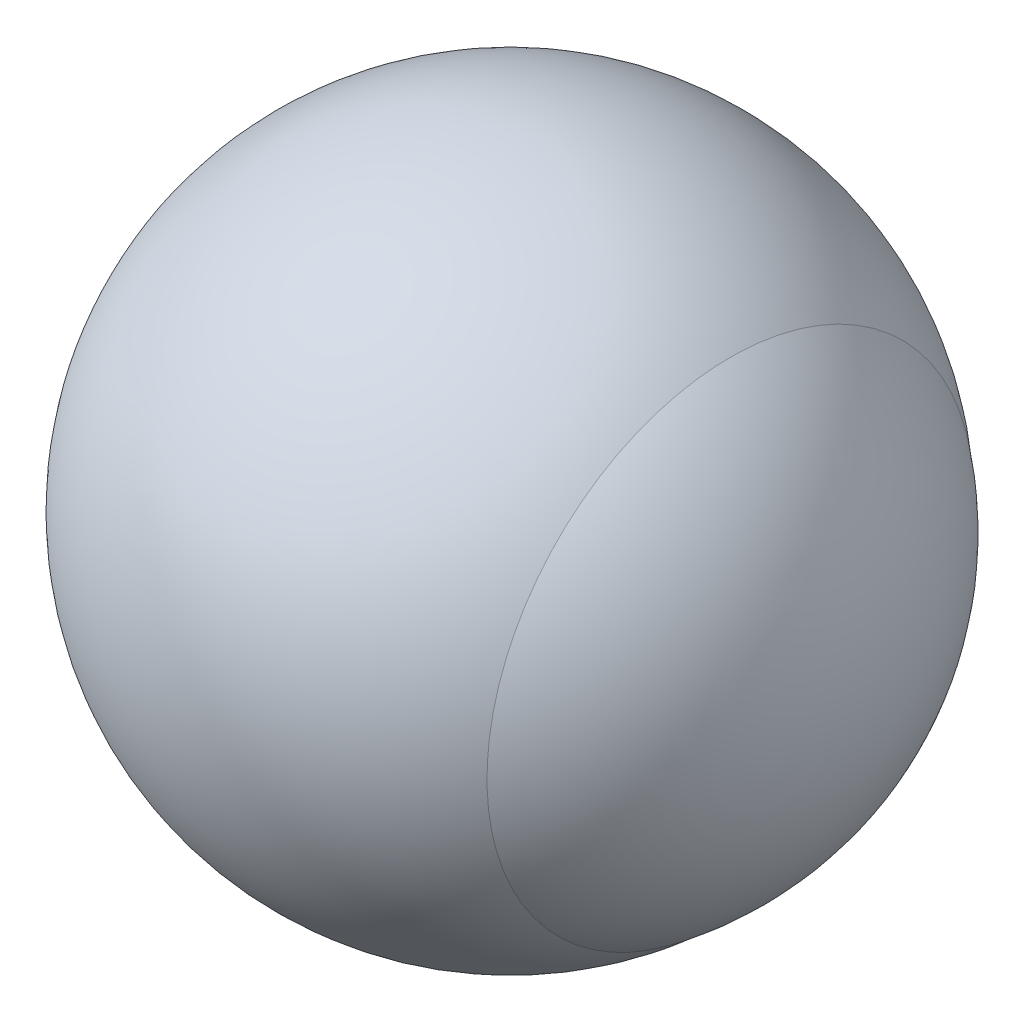
from build123d import *


with BuildPart() as part:
    # Эскиз5 → Повернуть1 (revolve)
    with BuildSketch(Plane(origin=(-13.435028843, 0, 0), x_dir=(0, 0, -1), z_dir=(1, 0, 0))):
        with BuildLine():
            Line((-10.564971157, 26.870057685), (37.435028843, 26.870057685))
            ThreePointArc((37.435028843, 26.870057685), (13.435028843, 50.870057685), (-10.564971157, 26.870057685))
        make_face()
    revolve(axis=Axis((-13.435028843, 26.870057685, 10.564971157), (0, 0, -1)))

    # Эскиз6 → Повернуть5 (revolve)
    with BuildSketch(Plane.XY.offset(-13.435028843)):
        with BuildLine():
            Line((11.564971157, 26.870057685), (10.564971157, 26.870057685))
            ThreePointArc((10.564971157, 26.870057685), (8.50114391, 36.606808939), (2.664610742, 44.668979148))
            ThreePointArc((2.664610742, 44.668979148), (9.215858607, 36.820158448), (11.564971157, 26.870057685))
        make_face()
    revolve(axis=Axis((11.564971157, 26.870057685, -13.435028843), (-1, 0, 0)))


solid = part.part
